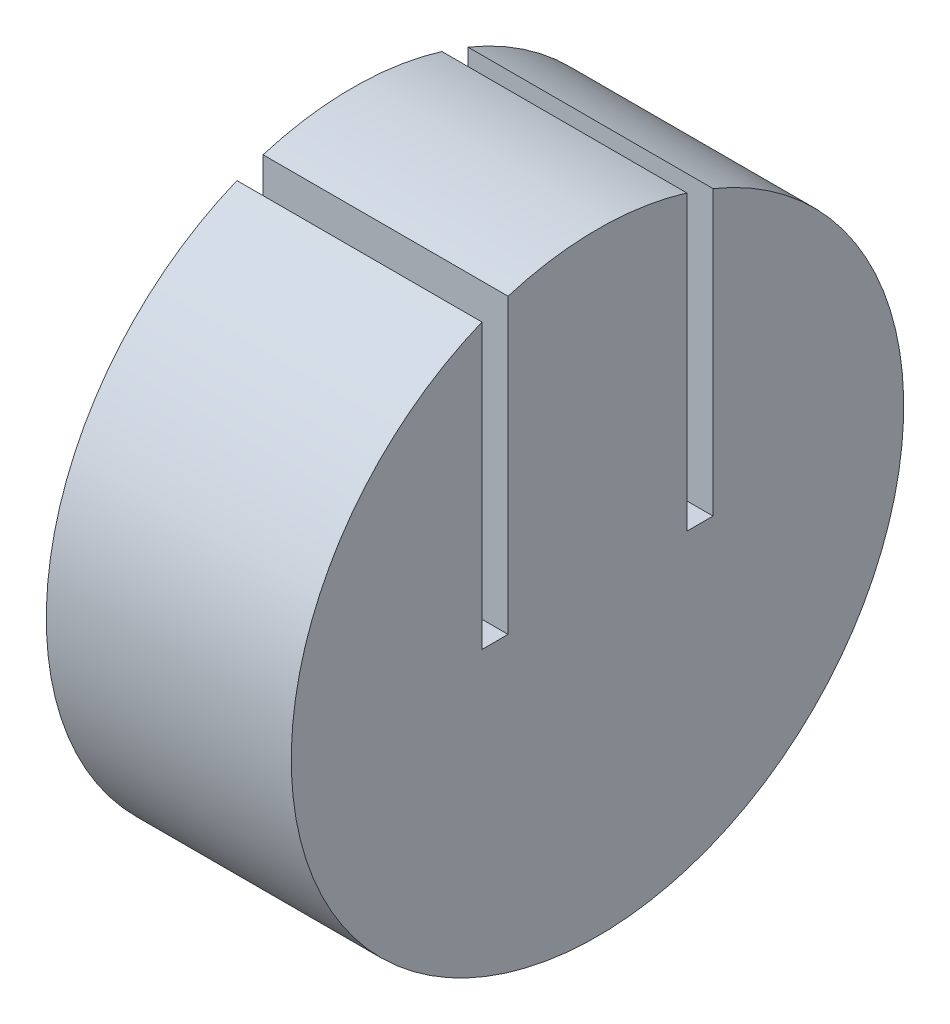
from build123d import *

# Parameters (mm, degrees)
BOSS_EXTRUDE1_DEPTH = 7.62


with BuildPart() as part:
    # Sketch1 → Boss-Extrude1 (new body)
    with BuildSketch(Plane(origin=(0, 0, 0), x_dir=(0, 0, -1), z_dir=(1, 0, 0))):
        with BuildLine():
            Line((-2.7813, 9.109884484), (-2.7813, 0))
            Line((-2.7813, 0), (2.7813, 0))
            Line((2.7813, 0), (2.7813, 9.109884484))
            ThreePointArc((2.7813, 9.109884484), (0, 9.525), (-2.7813, 9.109884484))
        make_face()
        with BuildLine():
            Line((2.7813, 0), (-2.7813, 0))
            Line((-2.7813, 0), (-3.5941, 0))
            Line((-3.5941, 0), (-3.5941, 8.820888288))
            ThreePointArc((-3.5941, 8.820888288), (-5.314688255, -7.904411031), (9.525, 0))
            ThreePointArc((9.525, 0), (7.904411031, 5.314688255), (3.5941, 8.820888288))
            Line((3.5941, 8.820888288), (3.5941, 0))
            Line((3.5941, 0), (2.7813, 0))
        make_face()
    extrude(amount=BOSS_EXTRUDE1_DEPTH)


solid = part.part
